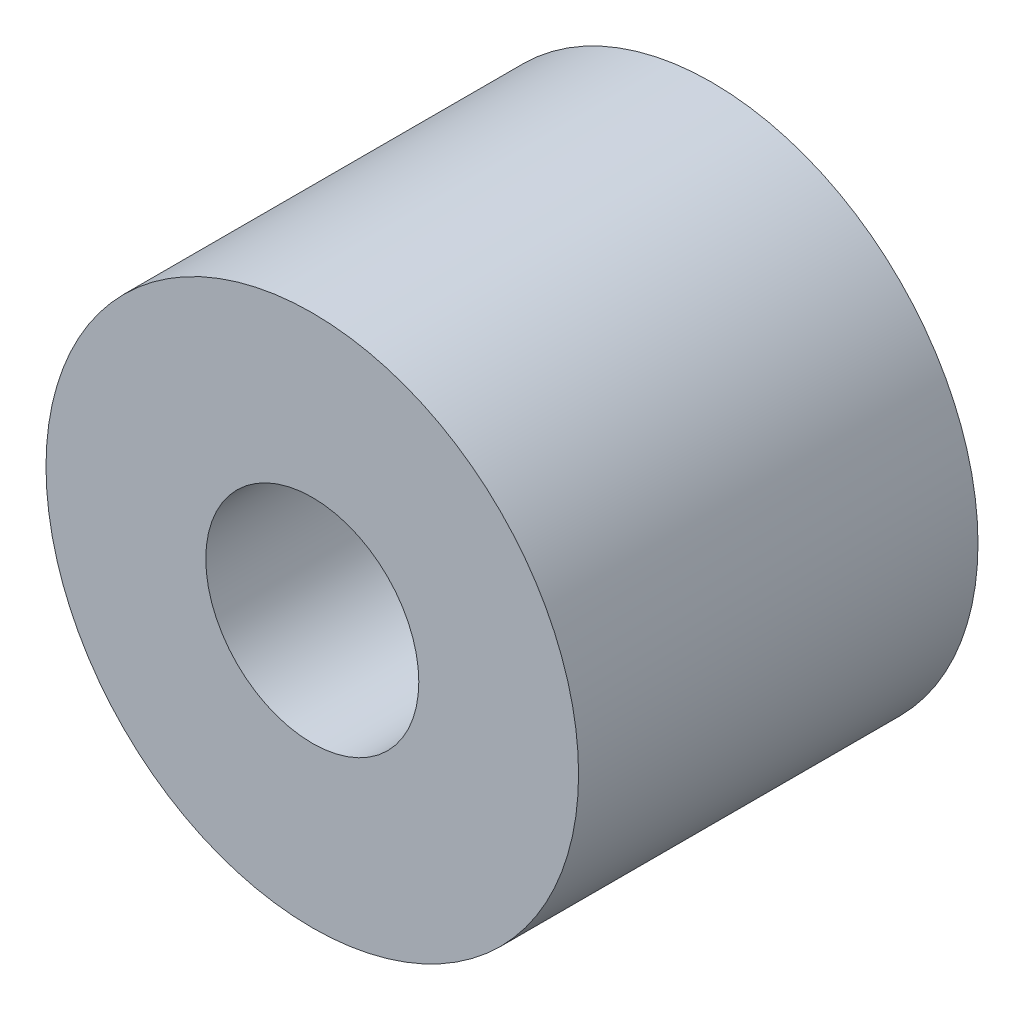
from build123d import *

# Parameters (mm, degrees)
SKETCH_2_R          = 10
EXTRUDE_1_DEPTH     = 15
SKETCH_3_R          = 4
CUT_EXTRUDE_1_DEPTH = 15


with BuildPart() as part:
    # 草图2 → 凸台-拉伸1 (new body)
    with BuildSketch(Plane.XY):
        Circle(SKETCH_2_R)
    extrude(amount=EXTRUDE_1_DEPTH)

    # 草图3 → 切除-拉伸1 (cut)
    with BuildSketch(Plane.XY):
        Circle(SKETCH_3_R)
    extrude(amount=CUT_EXTRUDE_1_DEPTH, mode=Mode.SUBTRACT)


solid = part.part
